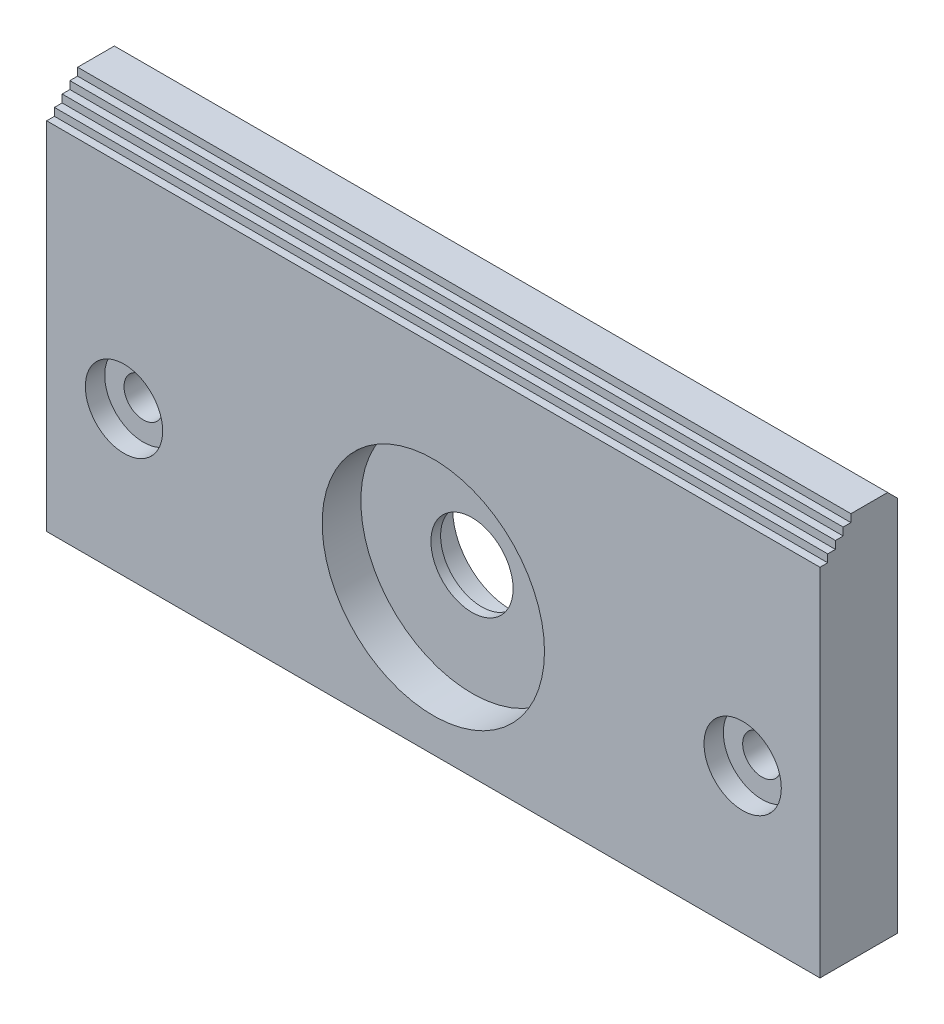
from build123d import *

# Parameters (mm, degrees)
SKETCH_1_W                     = 80
SKETCH_1_H                     = 60
EXTRUDE_1_DEPTH                = 8
HOLE_WIZARD_M3_5_1_D           = 4
HOLE_WIZARD_M3_5_1_CBORE_D     = 8
HOLE_WIZARD_M3_5_1_CBORE_DEPTH = 2
SKETCH_14_W                    = 80
SKETCH_14_H                    = 2
SKETCH_14_W_2                  = 2
SKETCH_14_H_2                  = 16
CUT_EXTRUDE_1_DEPTH            = 1
CUT_EXTRUDE_2_REACH            = 92.174
SKETCH_15_R                    = 4.25
SKETCH_17_R                    = 11.5
CUT_EXTRUDE_4_DEPTH            = 4
SKETCH_18_R                    = 6
CUT_EXTRUDE_5_DEPTH            = 3
CHAMFER_1_SIZE                 = 1.499999999
CHAMFER_1_SIZE2                = 1.500000001
CHAMFER_2_SIZE                 = 1
SKETCH_20_W                    = 80
SKETCH_20_H                    = 6
CUT_EXTRUDE_6_DEPTH            = 1
SKETCH_21_W                    = 80
SKETCH_21_H                    = 4
CUT_EXTRUDE_7_DEPTH            = 1
SKETCH_22_W                    = 80
SKETCH_22_H                    = 2
CUT_EXTRUDE_8_DEPTH            = 1
SKETCH_23_R                    = 1
CUT_EXTRUDE_9_DEPTH            = 1
CUT_EXTRUDE_10_REACH           = 92.174
SKETCH_24_W                    = 80
SKETCH_24_H                    = 20
EXTRUDE_2_DEPTH                = 3
CUT_EXTRUDE_11_REACH           = 92.174


with BuildPart() as part:
    # 草图1 → 凸台-拉伸1 (new body)
    with BuildSketch(Plane.XY.offset(8)):
        with Locations((40, 10.833333333)):
            Rectangle(SKETCH_1_W, SKETCH_1_H)
    extrude(amount=-EXTRUDE_1_DEPTH)

    # M3.5 六角头机械螺钉的柱形沉头孔1 (through all)
    with Locations(Plane.XY.offset(8)):
        with Locations((8, 15.833333333), (72, 15.833333333)):
            CounterBoreHole(HOLE_WIZARD_M3_5_1_D / 2, HOLE_WIZARD_M3_5_1_CBORE_D / 2, HOLE_WIZARD_M3_5_1_CBORE_DEPTH)

    # 草图14 → 切除-拉伸1 (cut)
    with BuildSketch(Plane.XY.offset(8)):
        with Locations((40, 37.833333333)):
            Rectangle(SKETCH_14_W, SKETCH_14_H)
        Polygon((15, 40.833333333), (31, 24.833333333), (32.414213562, 26.247546896), (16.414213562, 42.247546896), align=None)
        with Locations((7, 32.833333333)):
            Rectangle(SKETCH_14_W_2, SKETCH_14_H_2)
        with Locations((40, 32.833333333)):
            Rectangle(SKETCH_14_W_2, SKETCH_14_H_2)
        with Locations((73, 32.833333333)):
            Rectangle(SKETCH_14_W_2, SKETCH_14_H_2)
        Polygon((47.585786438, 26.247546896), (63.585786438, 42.247546896), (65, 40.833333333), (49, 24.833333333), align=None)
    extrude(amount=-CUT_EXTRUDE_1_DEPTH, mode=Mode.SUBTRACT)

    # 草图15 → 切除-拉伸2 (cut, up to next)
    with BuildSketch(Plane.XY.offset(8), mode=Mode.PRIVATE) as cut_extrude_2_sk1:
        with Locations((40, 15.833333333)):
            Circle(SKETCH_15_R)
    cut_extrude_2_tool1 = extrude(cut_extrude_2_sk1.sketch, amount=-CUT_EXTRUDE_2_REACH, mode=Mode.PRIVATE) & part.part
    add(cut_extrude_2_tool1.solids().sort_by_distance((40, 15.833333, 8))[0], mode=Mode.SUBTRACT)

    # 草图17 → 切除-拉伸4 (cut)
    with BuildSketch(Plane.XY.offset(8)):
        with Locations((40, 15.833333333)):
            Circle(SKETCH_17_R)
    extrude(amount=-CUT_EXTRUDE_4_DEPTH, mode=Mode.SUBTRACT)

    # 草图18 → 切除-拉伸5 (cut)
    with BuildSketch(Plane(origin=(0, 0, 0), x_dir=(-1, 0, 0), z_dir=(0, 0, -1))):
        with Locations((-40, 15.833333333)):
            Circle(SKETCH_18_R)
    extrude(amount=-CUT_EXTRUDE_5_DEPTH, mode=Mode.SUBTRACT)

    # 倒角1
    chamfer_1_edges = [part.edges().sort_by_distance(p)[0] for p in [
        (74, 15.833333333, 0),
        (10, 15.833333333, 0),
    ]]
    chamfer_1_side = [part.faces().sort_by_distance(p)[0] for p in [
        (79, 10.833333333, 0),
    ]]
    chamfer(chamfer_1_edges, length=CHAMFER_1_SIZE, length2=CHAMFER_1_SIZE2, reference=chamfer_1_side[0])

    # 倒角2
    chamfer_2_edges = [part.edges().sort_by_distance(p)[0] for p in [
        (40, 40.833333333, 0),
    ]]
    chamfer(chamfer_2_edges, length=CHAMFER_2_SIZE)

    # 草图20 → 切除-拉伸6 (cut)
    with BuildSketch(Plane.XY.offset(8)):
        with Locations((40, -16.166666667)):
            Rectangle(SKETCH_20_W, SKETCH_20_H)
    extrude(amount=-CUT_EXTRUDE_6_DEPTH, mode=Mode.SUBTRACT)

    # 草图21 → 切除-拉伸7 (cut)
    with BuildSketch(Plane.XY.offset(7)):
        with Locations((40, -17.166666667)):
            Rectangle(SKETCH_21_W, SKETCH_21_H)
    extrude(amount=-CUT_EXTRUDE_7_DEPTH, mode=Mode.SUBTRACT)

    # 草图22 → 切除-拉伸8 (cut)
    with BuildSketch(Plane.XY.offset(6)):
        with Locations((40, -18.166666667)):
            Rectangle(SKETCH_22_W, SKETCH_22_H)
    extrude(amount=-CUT_EXTRUDE_8_DEPTH, mode=Mode.SUBTRACT)

    # 草图23 → 切除-拉伸9 (cut)
    with BuildSketch(Plane.XY.offset(8)):
        with Locations((7, 24.833333333)):
            Circle(SKETCH_23_R)
        with Locations((31.707106781, 25.540440115)):
            Circle(SKETCH_23_R)
        with Locations((48.292893219, 25.540440115)):
            Circle(SKETCH_23_R)
        with Locations((73, 24.833333333)):
            Circle(SKETCH_23_R)
    extrude(amount=-CUT_EXTRUDE_9_DEPTH, mode=Mode.SUBTRACT)

    # 草图24 → 切除-拉伸10 (cut, up to next)
    with BuildSketch(Plane.XY.offset(8), mode=Mode.PRIVATE) as cut_extrude_10_sk1:
        with Locations((40, -9.166666667)):
            Rectangle(SKETCH_24_W, SKETCH_24_H)
    cut_extrude_10_tool1 = extrude(cut_extrude_10_sk1.sketch, amount=-CUT_EXTRUDE_10_REACH, mode=Mode.PRIVATE) & part.part
    add(cut_extrude_10_tool1.solids().sort_by_distance((40, -9.166667, 8))[0], mode=Mode.SUBTRACT)

    # 草图25 → 凸台-拉伸2 (add)
    with BuildSketch(Plane.XY.offset(8)):
        with BuildLine():
            Line((0, 40.833333333), (80, 40.833333333))
            Line((80, 40.833333333), (80, 22.833333333))
            Line((80, 22.833333333), (49.124143795, 22.833333333))
            ThreePointArc((49.124143795, 22.833333333), (40, 27.333333333), (30.875856205, 22.833333333))
            Line((30.875856205, 22.833333333), (0, 22.833333333))
            Line((0, 22.833333333), (0, 40.833333333))
        make_face()
    extrude(amount=-EXTRUDE_2_DEPTH)

    # 草图26 → 切除-拉伸11 (cut, up to next)
    with BuildSketch(Plane.ZY, mode=Mode.PRIVATE) as cut_extrude_11_sk1:
        Polygon((4.8, 40.833333333), (4.8, 40.033333333), (5.6, 40.033333333), (5.6, 39.233333333), (6.4, 39.233333333), (6.4, 38.433333333), (7.2, 38.433333333), (7.2, 37.633333333), (8, 37.633333333), (8, 40.833333333), align=None)
    cut_extrude_11_tool1 = extrude(cut_extrude_11_sk1.sketch, amount=-CUT_EXTRUDE_11_REACH, mode=Mode.PRIVATE) & part.part
    add(cut_extrude_11_tool1.solids().sort_by_distance((0, 39.633333, 6.8))[0], mode=Mode.SUBTRACT)


solid = part.part
